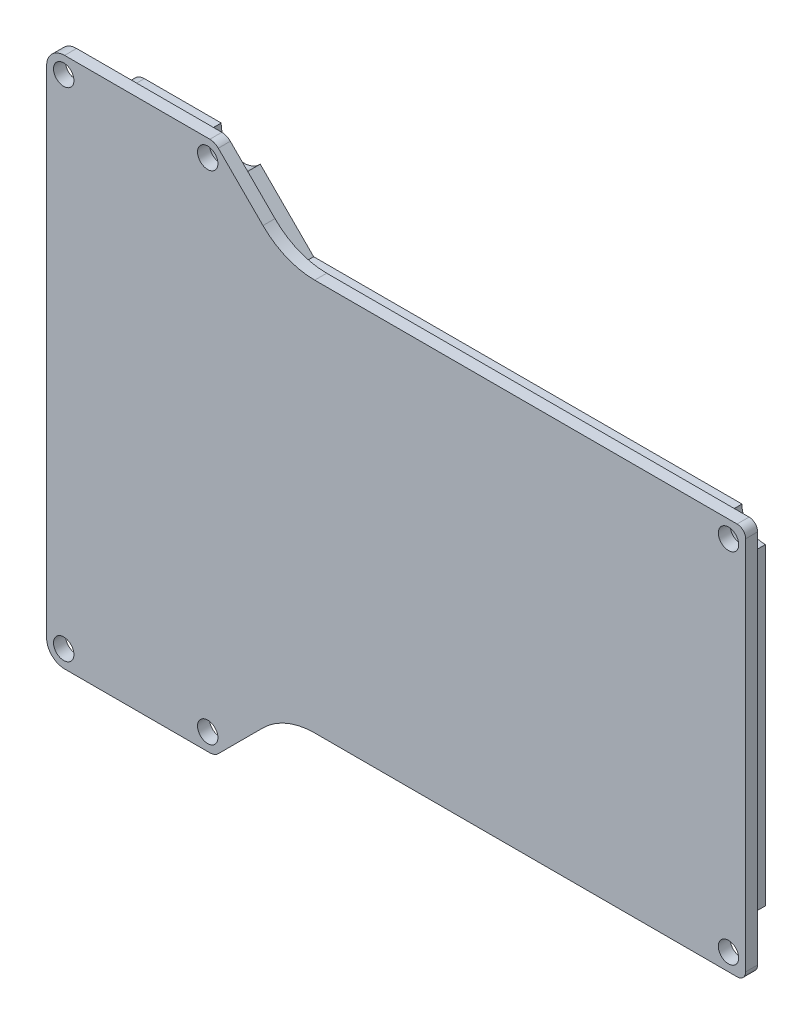
from build123d import *

# Parameters (mm, degrees)
BOSS_EXTRUDE1_DEPTH = 2
BOSS_EXTRUDE2_DEPTH = 4
SKETCH1_4_R         = 1.7
CUT_EXTRUDE1_DEPTH  = 10


with BuildPart() as part:
    # Sketch1 → Boss-Extrude1 (new body)
    with BuildSketch(Plane.XY):
        with BuildLine():
            Line((28.78011557, -21.498473491), (21.333027704, -14.051385626))
            ThreePointArc((21.333027704, -14.051385626), (20.684181007, -13.617840123), (19.918814142, -13.465599188))
            Line((19.918814142, -13.465599188), (-4.3, -13.465599188))
            ThreePointArc((-4.3, -13.465599188), (-6.421320344, -14.344278845), (-7.3, -16.465599188))
            Line((-7.3, -16.465599188), (-7.3, -99.073599188))
            ThreePointArc((-7.3, -99.073599188), (-6.421320344, -101.194919532), (-4.3, -102.073599188))
            Line((-4.3, -102.073599188), (19.918814142, -102.073599188))
            ThreePointArc((19.918814142, -102.073599188), (20.684181007, -101.921358253), (21.333027704, -101.48781275))
            Line((21.333027704, -101.48781275), (28.78511557, -94.035724885))
            ThreePointArc((28.78511557, -94.035724885), (32.741782732, -91.39196441), (37.408989873, -90.463599188))
            Line((37.408989873, -90.463599188), (107.834, -90.463599188))
            ThreePointArc((107.834, -90.463599188), (108.841627163, -90.046226351), (109.259, -89.038599188))
            Line((109.259, -89.038599188), (109.259, -26.495599188))
            ThreePointArc((109.259, -26.495599188), (108.841627163, -25.487972025), (107.834, -25.070599188))
            Line((107.834, -25.070599188), (37.403989873, -25.070599188))
            ThreePointArc((37.403989873, -25.070599188), (32.736782732, -24.142233967), (28.78011557, -21.498473491))
        make_face()
    extrude(amount=BOSS_EXTRUDE1_DEPTH)

    # Sketch1<3> → Boss-Extrude2 (add)
    with BuildSketch(Plane.XY):
        with BuildLine():
            Line((3, -16.169599188), (15.815448907, -16.169599188))
            ThreePointArc((15.815448907, -16.169599188), (18.129279051, -19.785919074), (22.322528351, -18.864919746))
            Line((22.322528351, -18.864919746), (31.232207794, -27.774599188))
            Line((31.232207794, -27.774599188), (102.655958934, -27.774599188))
            ThreePointArc((102.655958934, -27.774599188), (103.75222825, -30.577370938), (106.555, -31.673640255))
            Line((106.555, -31.673640255), (106.555, -83.860558122))
            ThreePointArc((106.555, -83.860558122), (103.75222825, -84.956827438), (102.655958934, -87.759599188))
            Line((102.655958934, -87.759599188), (31.237207794, -87.759599188))
            Line((31.237207794, -87.759599188), (22.322528351, -96.674278631))
            ThreePointArc((22.322528351, -96.674278631), (18.129279051, -95.753279303), (15.815448907, -99.369599188))
            Line((15.815448907, -99.369599188), (3, -99.369599188))
            ThreePointArc((3, -99.369599188), (1.51507576, -98.754523429), (0.9, -97.269599188))
            Line((0.9, -97.269599188), (0.9, -18.269599188))
            ThreePointArc((0.9, -18.269599188), (1.51507576, -16.784674948), (3, -16.169599188))
        make_face()
        with BuildLine():
            ThreePointArc((3, -17.969599188), (2.787867966, -18.057467154), (2.7, -18.269599188))
            Line((2.7, -18.269599188), (2.7, -42.574599188))
            Line((2.7, -42.574599188), (22, -42.574599188))
            Line((22, -42.574599188), (90.115, -42.574599188))
            Line((90.115, -42.574599188), (104.755, -42.574599188))
            Line((104.755, -42.574599188), (104.755, -33.225486399))
            ThreePointArc((104.755, -33.225486399), (102.479436044, -31.850163144), (101.104112789, -29.574599188))
            Line((101.104112789, -29.574599188), (30.486623382, -29.574599188))
            Line((30.486623382, -29.574599188), (22.147057077, -21.235032884))
            ThreePointArc((22.147057077, -21.235032884), (17.440448873, -21.448902232), (14.263602762, -17.969599188))
            Line((14.263602762, -17.969599188), (3, -17.969599188))
        make_face(mode=Mode.SUBTRACT)
        with BuildLine():
            ThreePointArc((2.7, -97.269599188), (2.787867966, -97.481731222), (3, -97.569599188))
            Line((3, -97.569599188), (14.263602762, -97.569599188))
            ThreePointArc((14.263602762, -97.569599188), (17.440448873, -94.090296144), (22.147057077, -94.304165492))
            Line((22.147057077, -94.304165492), (30.491623382, -85.959599188))
            Line((30.491623382, -85.959599188), (101.104112789, -85.959599188))
            ThreePointArc((101.104112789, -85.959599188), (102.479436044, -83.684035232), (104.755, -82.308711977))
            Line((104.755, -82.308711977), (104.755, -71.279599188))
            Line((104.755, -71.279599188), (90.115, -71.279599188))
            Line((90.115, -71.279599188), (22, -71.279599188))
            Line((22, -71.279599188), (2.7, -71.279599188))
            Line((2.7, -71.279599188), (2.7, -97.269599188))
        make_face(mode=Mode.SUBTRACT)
        Polygon((22, -69.479599188), (2.7, -69.479599188), (2.7, -44.374599188), (22, -44.374599188), (90.115, -44.374599188), (104.755, -44.374599188), (104.755, -69.479599188), (90.115, -69.479599188), align=None, mode=Mode.SUBTRACT)
    extrude(amount=-BOSS_EXTRUDE2_DEPTH)

    # Sketch1<4> → Cut-Extrude1 (cut)
    with BuildSketch(Plane.XY):
        with Locations((106.406, -27.923599188)):
            Circle(SKETCH1_4_R)
        with Locations((106.406, -87.610599188)):
            Circle(SKETCH1_4_R)
        with Locations((19.565489973, -99.220599188)):
            Circle(SKETCH1_4_R)
        with Locations((-4.447, -99.220599188)):
            Circle(SKETCH1_4_R)
        with Locations((-4.447, -16.318599188)):
            Circle(SKETCH1_4_R)
        with Locations((19.565489973, -16.318599188)):
            Circle(SKETCH1_4_R)
    extrude(amount=CUT_EXTRUDE1_DEPTH, mode=Mode.SUBTRACT)


solid = part.part
